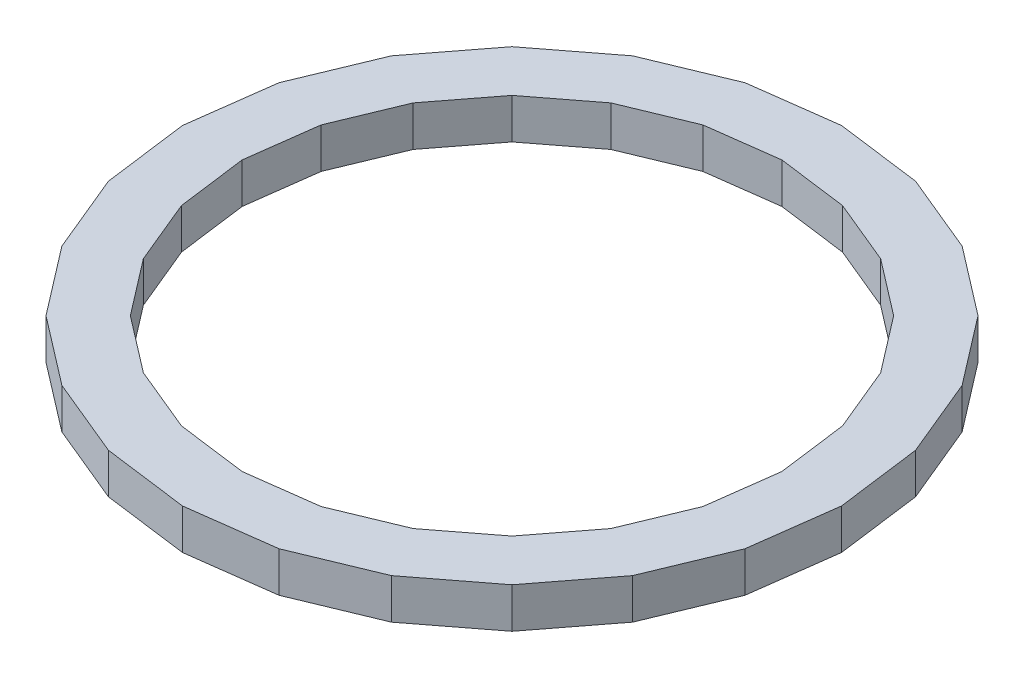
from build123d import *

# Parameters (mm, degrees)
BOSS_EXTRUDE3_DEPTH = 19.05


with BuildPart() as part:
    # Sketch3 → Boss-Extrude3 (new body)
    with BuildSketch(Plane(origin=(0, 0, 0), x_dir=(1, 0, 0), z_dir=(0, 1, 0))):
        Polygon((-155.677566735, 0), (-150.372982283, -40.292319166), (-134.820727592, -77.838783367), (-110.080663117, -110.080663117), (-77.838783367, -134.820727592), (-40.292319166, -150.372982283), (0, -155.677566735), (40.292319166, -150.372982283), (77.838783367, -134.820727592), (110.080663117, -110.080663117), (134.820727592, -77.838783367), (150.372982283, -40.292319166), (155.677566735, 0), (150.372982283, 40.292319166), (134.820727592, 77.838783367), (110.080663117, 110.080663117), (77.838783367, 134.820727592), (40.292319166, 150.372982283), (0, 155.677566735), (-40.292319166, 150.372982283), (-77.838783367, 134.820727592), (-110.080663117, 110.080663117), (-134.820727592, 77.838783367), (-150.372982283, 40.292319166), align=None)
        Polygon((-127.496473576, 0), (-123.152136588, -32.998515545), (-110.41518501, -63.748236788), (-90.153621043, -90.153621043), (-63.748236788, -110.41518501), (-32.998515545, -123.152136588), (0, -127.496473576), (32.998515545, -123.152136588), (63.748236788, -110.41518501), (90.153621043, -90.153621043), (110.41518501, -63.748236788), (123.152136588, -32.998515545), (127.496473576, 0), (123.152136588, 32.998515545), (110.41518501, 63.748236788), (90.153621043, 90.153621043), (63.748236788, 110.41518501), (32.998515545, 123.152136588), (0, 127.496473576), (-32.998515545, 123.152136588), (-63.748236788, 110.41518501), (-90.153621043, 90.153621043), (-110.41518501, 63.748236788), (-123.152136588, 32.998515545), align=None, mode=Mode.SUBTRACT)
    extrude(amount=BOSS_EXTRUDE3_DEPTH)


solid = part.part
